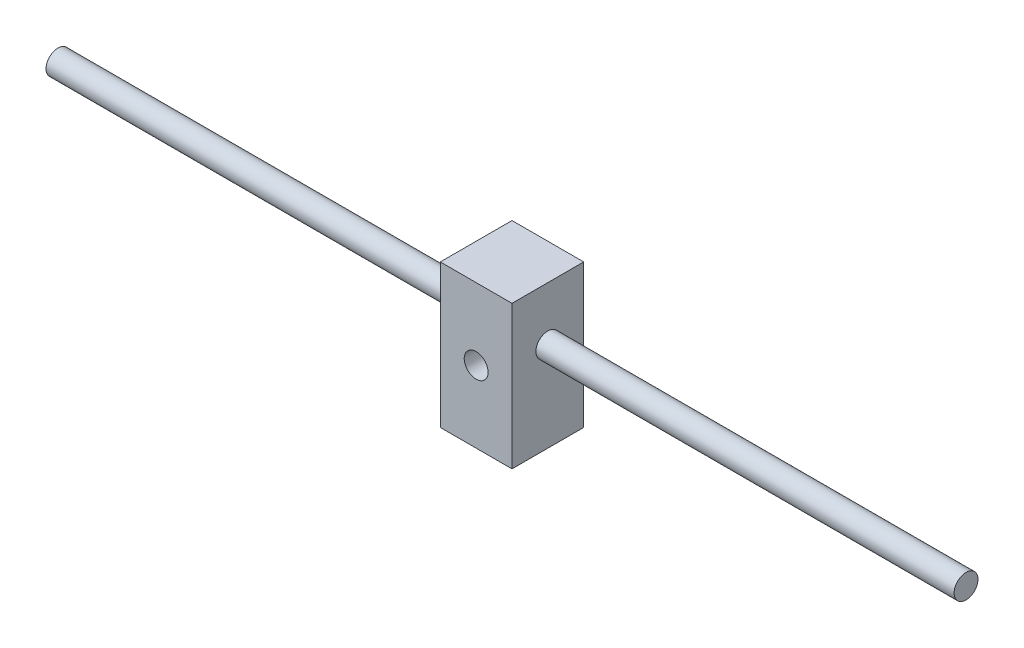
from build123d import *

# Parameters (mm, degrees)
SKETCH_1_W      = 60
SKETCH_1_H      = 120
SKETCH_1_R      = 10
EXTRUDE_1_DEPTH = 30
SKETCH_2_R      = 10
EXTRUDE_2_DEPTH = 350
EXTRUDE_START   = 350
SKETCH_3_R      = 10
EXTRUDE_3_DEPTH = 350


with BuildPart() as part:
    # Эскиз1 → Бобышка-Вытянуть1 (new, symmetric)
    with BuildSketch(Plane.XY):
        Rectangle(SKETCH_1_W, SKETCH_1_H)
        with Locations(Location((0, 0, 0), (0, 0, 180))):
            Circle(SKETCH_1_R, mode=Mode.SUBTRACT)
    extrude(amount=EXTRUDE_1_DEPTH, both=True)

    # Эскиз2 → Бобышка-Вытянуть2 (add)
    with BuildSketch(Plane.ZY.offset(30)):
        with Locations(Location((0, 15, 0), (0, 0, 270))):
            Circle(SKETCH_2_R)
    extrude(amount=EXTRUDE_2_DEPTH)

    # Эскиз3 → Бобышка-Вытянуть3 (add)
    with BuildSketch(Plane(origin=(30, 0, 0), x_dir=(0, 0, -1), z_dir=(1, 0, 0)).offset(EXTRUDE_START)):
        with Locations(Location((0, 15, 0), (0, 0, 270))):
            Circle(SKETCH_3_R)
    extrude(amount=-EXTRUDE_3_DEPTH)


solid = part.part
